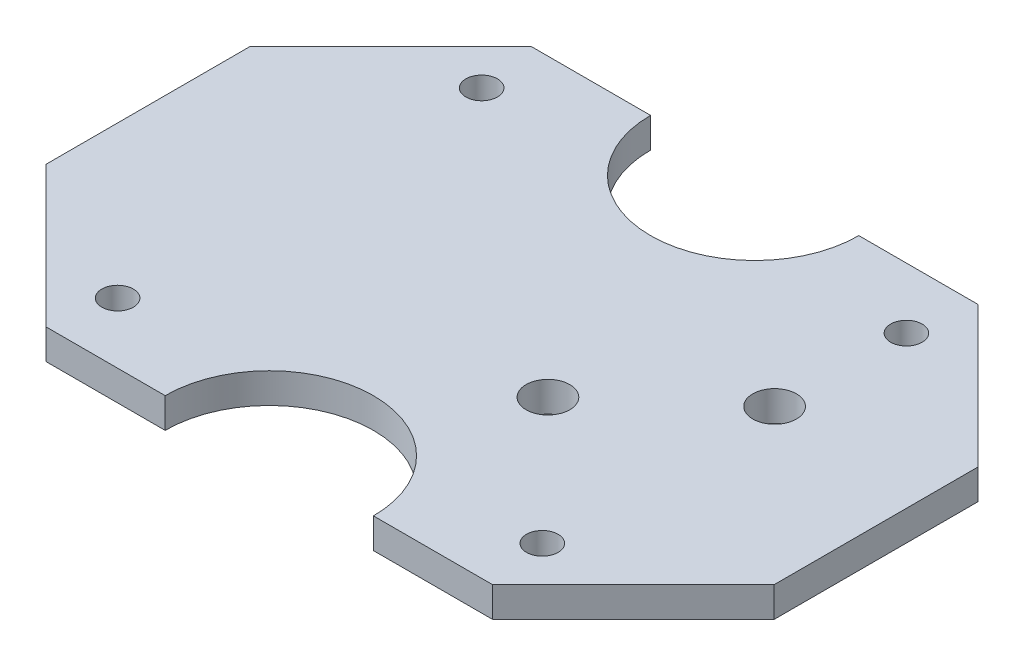
from build123d import *

# Parameters (mm, degrees)
SKETCH1_R           = 1.651
SKETCH1_R_2         = 2.286
BOSS_EXTRUDE1_DEPTH = 3.1496


with BuildPart() as part:
    # Sketch1 → Boss-Extrude1 (new body)
    with BuildSketch(Plane(origin=(0, 0, 0), x_dir=(1, 0, 0), z_dir=(0, 1, 0))):
        with BuildLine():
            Line((23.368, -25.4), (38.1, -10.668))
            Line((38.1, -10.668), (38.1, 10.668))
            Line((38.1, 10.668), (23.368, 25.4))
            Line((23.368, 25.4), (10.899655632, 25.4))
            ThreePointArc((10.899655632, 25.4), (0, 14.500344368), (-10.899655632, 25.4))
            Line((-10.899655632, 25.4), (-23.368, 25.4))
            Line((-23.368, 25.4), (-38.1, 10.668))
            Line((-38.1, 10.668), (-38.1, -10.668))
            Line((-38.1, -10.668), (-23.368, -25.4))
            Line((-23.368, -25.4), (-10.899655632, -25.4))
            ThreePointArc((-10.899655632, -25.4), (0, -14.500344368), (10.899655632, -25.4))
            Line((10.899655632, -25.4), (23.368, -25.4))
        make_face()
        with Locations(Location((-22.225, 19.05, 0), (0, 0, 270))):
            Circle(SKETCH1_R, mode=Mode.SUBTRACT)
        with Locations(Location((22.225, 19.05, 0), (0, 0, 270))):
            Circle(SKETCH1_R, mode=Mode.SUBTRACT)
        with Locations(Location((22.225, -19.05, 0), (0, 0, 270))):
            Circle(SKETCH1_R, mode=Mode.SUBTRACT)
        with Locations(Location((-22.225, -19.05, 0), (0, 0, 270))):
            Circle(SKETCH1_R, mode=Mode.SUBTRACT)
        with Locations(Location((9.271, -5.5118, 0), (0, 0, 270))):
            Circle(SKETCH1_R_2, mode=Mode.SUBTRACT)
        with Locations(Location((21.971, 5.5118, 0), (0, 0, 270))):
            Circle(SKETCH1_R_2, mode=Mode.SUBTRACT)
    extrude(amount=BOSS_EXTRUDE1_DEPTH)


solid = part.part
